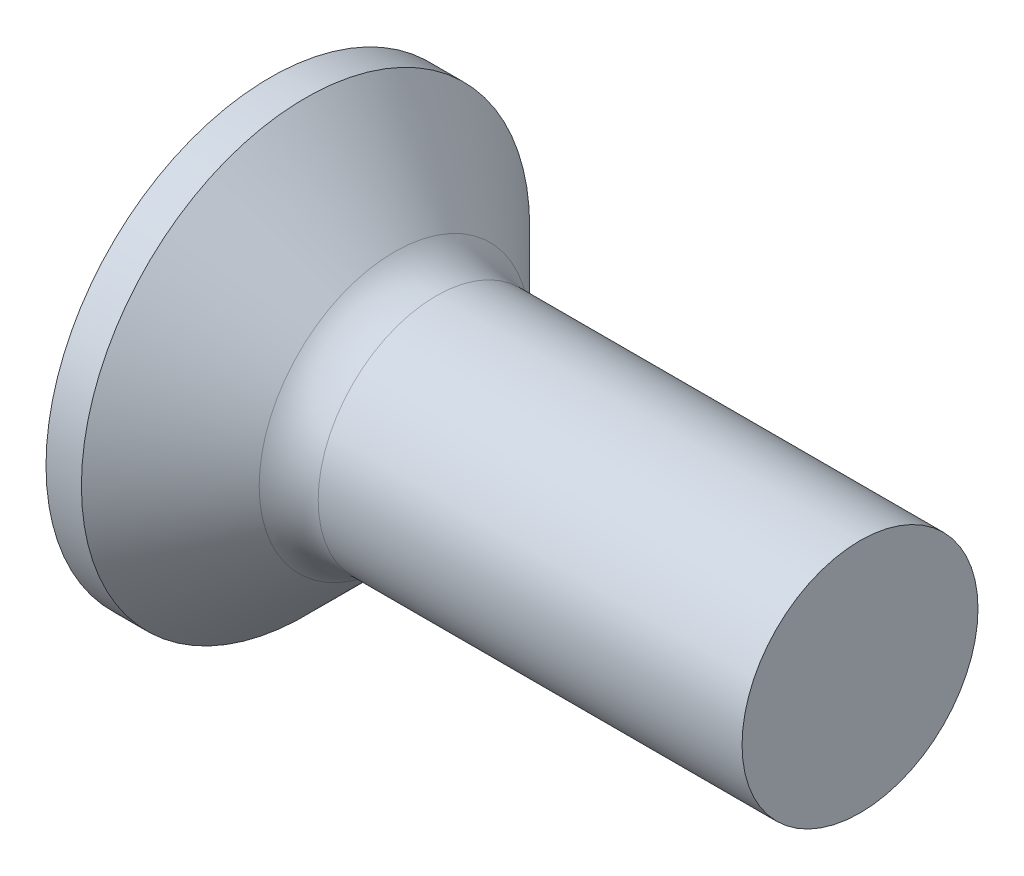
from build123d import *

# Parameters (mm, degrees)
FILLET1_R    = 0.5
RECPAT_COUNT = 2
RECPAT_ANGLE = 90


with BuildPart() as part:
    # BodySke → Base-Revolve (revolve)
    with BuildSketch(Plane.XY, mode=Mode.PRIVATE) as base_revolve_sk:
        Polygon((0, 0), (0, 1.9), (0.3, 1.9), (1.2, 1), (5, 1), (5, 0), align=None)
    revolve(base_revolve_sk.sketch.rotate(Axis((-6.35, 0, 0), (1, 0, 0)), 90), axis=Axis((-6.35, 0, 0), (1, 0, 0)))

    # Fillet1
    fillet1_edges = [part.edges().sort_by_distance(p)[0] for p in [
        (1.2, 0, -1),
    ]]
    fillet(fillet1_edges, radius=FILLET1_R)

    # Sketch3 → Recess section 0
    with BuildSketch(Plane.ZY):
        with BuildLine():
            Line((-0.24, 0.95), (0.24, 0.95))
            Line((0.24, 0.95), (0.24, -0.95))
            Line((0.24, -0.95), (-0.24, -0.95))
            Line((-0.24, -0.95), (-0.24, 0.95))
        make_face()
    # Sketch4 → Recess section 1
    with BuildSketch(Plane.ZY.offset(-1.2)):
        with BuildLine():
            Line((-0.24, 0.351702091), (0.24, 0.351702091))
            Line((0.24, 0.351702091), (0.24, -0.351702091))
            Line((0.24, -0.351702091), (-0.24, -0.351702091))
            Line((-0.24, -0.351702091), (-0.24, 0.351702091))
        make_face()
    recess = loft(mode=Mode.SUBTRACT)

    # RecPat: Recess ×2 about axis
    recpat_axis = Axis((0, 0, 0), (1, 0, 0))
    for i in range(1, RECPAT_COUNT):
        add(recess.rotate(recpat_axis, i * RECPAT_ANGLE / (RECPAT_COUNT - 1)), mode=Mode.SUBTRACT)

    # RecCorSke → RecessCore (revolve, cut)
    with BuildSketch(Plane.XY, mode=Mode.PRIVATE) as recesscore_sk:
        Polygon((0, 0), (0, 0.439412174), (1.2, 0.3555), (1.315508952, 0), align=None)
    revolve(recesscore_sk.sketch.rotate(Axis((-3.175, 0, 0), (1, 0, 0)), 90), axis=Axis((-3.175, 0, 0), (1, 0, 0)), mode=Mode.SUBTRACT)


solid = part.part
